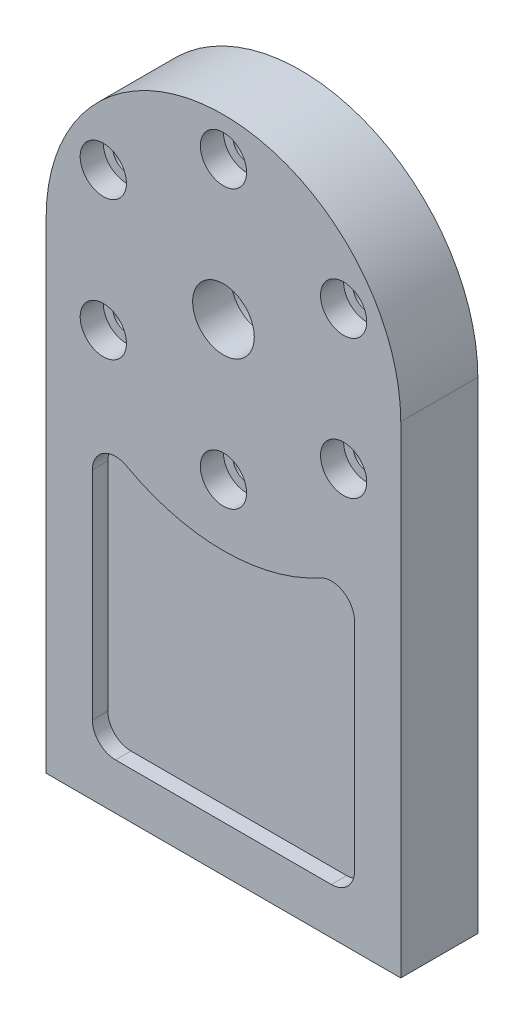
from build123d import *

# Parameters (mm, degrees)
SKETCH2_R                         = 3.5
SKETCH2_R_2                       = 8
BOSS_EXTRUDE1_DEPTH               = 10
SKETCH4_R                         = 6
CUT_EXTRUDE1_DEPTH                = 6
CUT_EXTRUDE2_DEPTH                = 4
SKETCH6_R                         = 12.5
CUT_EXTRUDE3_DEPTH                = 10
TAP_DRILL_FOR_M10X1_25_TAP1_D     = 8.8
TAP_DRILL_FOR_M10X1_25_TAP1_DEPTH = 24
TAP_DRILL_FOR_M10X1_25_TAP1_TIP   = 2.643786724


with BuildPart() as part:
    # Sketch2 → Boss-Extrude1 (new, symmetric)
    with BuildSketch(Plane.XY):
        with BuildLine():
            Line((-46, 0), (-46, -125))
            Line((-46, -125), (46, -125))
            Line((46, -125), (46, 0))
            ThreePointArc((46, 0), (0, 46), (-46, 0))
        make_face()
        with Locations((0, 36)):
            Circle(SKETCH2_R, mode=Mode.SUBTRACT)
        Circle(SKETCH2_R_2, mode=Mode.SUBTRACT)
        with Locations((31.176914536, 18)):
            Circle(SKETCH2_R, mode=Mode.SUBTRACT)
        with Locations((31.176914536, -18)):
            Circle(SKETCH2_R, mode=Mode.SUBTRACT)
        with Locations((0, -36)):
            Circle(SKETCH2_R, mode=Mode.SUBTRACT)
        with Locations((-31.176914536, -18)):
            Circle(SKETCH2_R, mode=Mode.SUBTRACT)
        with Locations((-31.176914536, 18)):
            Circle(SKETCH2_R, mode=Mode.SUBTRACT)
    extrude(amount=BOSS_EXTRUDE1_DEPTH, both=True)

    # Sketch4 → Cut-Extrude1 (cut)
    with BuildSketch(Plane.XY.offset(10)):
        with Locations((0, 36)):
            Circle(SKETCH4_R)
        with Locations((31.176914536, 18)):
            Circle(SKETCH4_R)
        with Locations((31.176914536, -18)):
            Circle(SKETCH4_R)
        with Locations((0, -36)):
            Circle(SKETCH4_R)
        with Locations((-31.176914536, -18)):
            Circle(SKETCH4_R)
        with Locations((-31.176914536, 18)):
            Circle(SKETCH4_R)
    extrude(amount=-CUT_EXTRUDE1_DEPTH, mode=Mode.SUBTRACT)

    # Sketch5 → Cut-Extrude2 (cut)
    with BuildSketch(Plane.XY.offset(10)):
        with BuildLine():
            Line((34, -107), (34, -50.793700397))
            ThreePointArc((34, -50.793700397), (31.051285766, -45.627497229), (25.103448276, -45.539179666))
            ThreePointArc((25.103448276, -45.539179666), (0, -52), (-25.103448276, -45.539179666))
            ThreePointArc((-25.103448276, -45.539179666), (-31.051285766, -45.627497229), (-34, -50.793700397))
            Line((-34, -50.793700397), (-34, -107))
            ThreePointArc((-34, -107), (-32.242640687, -111.242640687), (-28, -113))
            Line((-28, -113), (28, -113))
            ThreePointArc((28, -113), (32.242640687, -111.242640687), (34, -107))
        make_face()
    cut_extrude2 = extrude(amount=-CUT_EXTRUDE2_DEPTH, mode=Mode.SUBTRACT)

    # Mirror1: Cut-Extrude2 across plane
    add(cut_extrude2.mirror(Plane.XY), mode=Mode.SUBTRACT)

    # Sketch6 → Cut-Extrude3 (cut)
    with BuildSketch(Plane(origin=(0, 0, -10), x_dir=(-1, 0, 0), z_dir=(0, 0, -1))):
        Circle(SKETCH6_R)
    extrude(amount=-CUT_EXTRUDE3_DEPTH, mode=Mode.SUBTRACT)

    # Tap Drill for M10x1.25 Tap1
    with Locations(Plane(origin=(0, -125, 0), x_dir=(-1, 0, 0), z_dir=(0, -1, 0))):
        with Locations((-30, 0), (30, 0)):
            Hole(TAP_DRILL_FOR_M10X1_25_TAP1_D / 2, depth=TAP_DRILL_FOR_M10X1_25_TAP1_DEPTH)
            with Locations((0, 0, -(TAP_DRILL_FOR_M10X1_25_TAP1_DEPTH + TAP_DRILL_FOR_M10X1_25_TAP1_TIP / 2))):  # 118° drill point
                Cone(0, TAP_DRILL_FOR_M10X1_25_TAP1_D / 2, TAP_DRILL_FOR_M10X1_25_TAP1_TIP, mode=Mode.SUBTRACT)


solid = part.part
